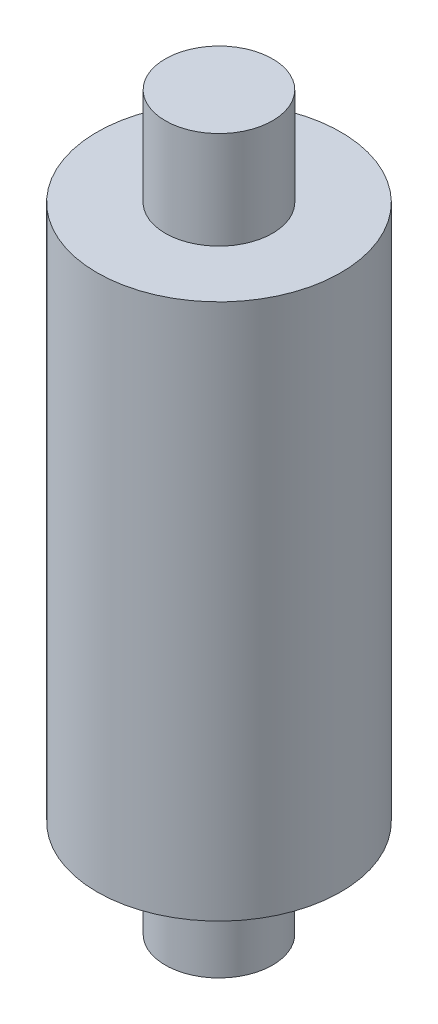
from build123d import *

# Parameters (mm, degrees)
SKETCH_1_R      = 2.5
EXTRUDE_1_DEPTH = 11
SKETCH_2_R      = 1.1
EXTRUDE_2_DEPTH = 2
EXTRUDE_START   = 2
SKETCH_4_R      = 1.1
EXTRUDE_3_DEPTH = 2


with BuildPart() as part:
    # Эскиз1 → Бобышка-Вытянуть1 (new body)
    with BuildSketch(Plane(origin=(0, 0, 0), x_dir=(1, 0, 0), z_dir=(0, 1, 0))):
        with Locations(Location((0, 0, 0), (0, 0, 270))):
            Circle(SKETCH_1_R)
    extrude(amount=EXTRUDE_1_DEPTH)

    # Эскиз2 → Бобышка-Вытянуть2 (add)
    with BuildSketch(Plane(origin=(0, 11, 0), x_dir=(1, 0, 0), z_dir=(0, 1, 0))):
        with Locations(Location((0, 0, 0), (0, 0, 270))):
            Circle(SKETCH_2_R)
    extrude(amount=EXTRUDE_2_DEPTH)

    # Эскиз4 → Бобышка-Вытянуть3 (add)
    with BuildSketch(Plane.XZ.offset(EXTRUDE_START)):
        with Locations(Location((0, 0, 0), (0, 0, 90))):
            Circle(SKETCH_4_R)
    extrude(amount=-EXTRUDE_3_DEPTH)


solid = part.part
